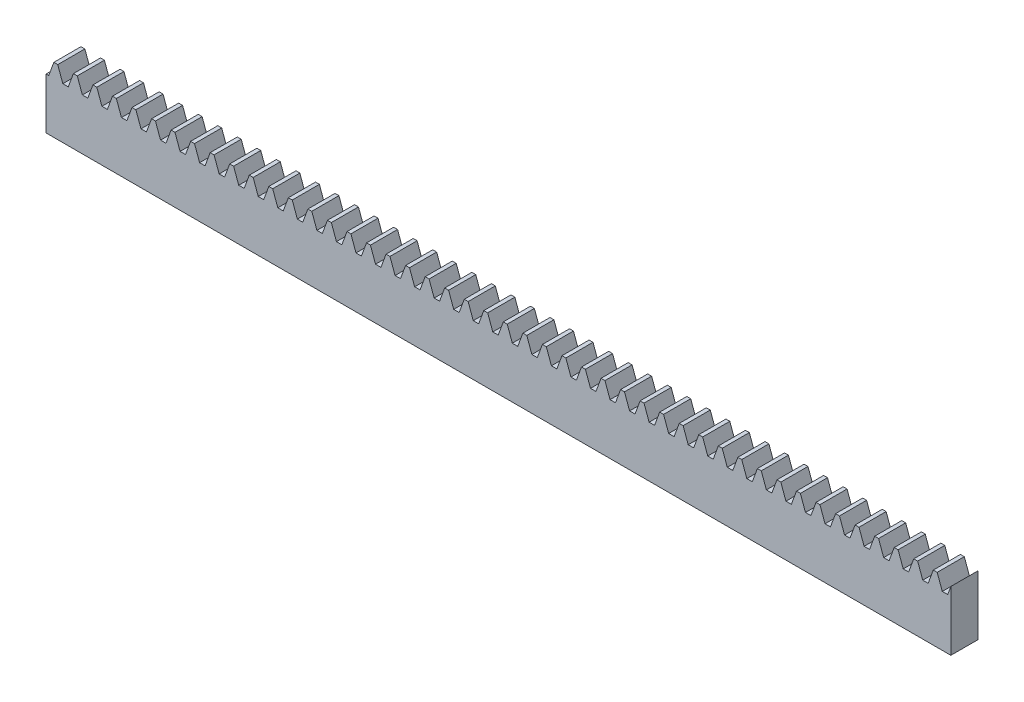
from build123d import *

# Parameters (mm, degrees)
BLANKSKE_W        = 200
BLANKSKE_H        = 14.375
BLANK_DEPTH       = 6
TOOTHCUTSIM_DEPTH = 201.605684428
TEETHCUTS_COUNT   = 47
TEETHCUTS_PITCH   = 4.319689894


with BuildPart() as part:
    # BlankSke → Blank (new body)
    with BuildSketch(Plane.XY):
        with Locations((100, 7.1875)):
            Rectangle(BLANKSKE_W, BLANKSKE_H)
    extrude(amount=-BLANK_DEPTH)

    # TooCutSkeSim → ToothCutSim (cut, through all)
    with BuildSketch(Plane.XY):
        Polygon((0.601348633, 11.28125), (-0.601348633, 11.28125), (-1.73662639, 14.4004), (1.73662639, 14.4004), align=None)
    toothcutsim = extrude(amount=-TOOTHCUTSIM_DEPTH, mode=Mode.SUBTRACT)

    # TeethCuts: ToothCutSim ×47
    with Locations(*[(i * TEETHCUTS_PITCH, 0, 0) for i in range(1, TEETHCUTS_COUNT)]):
        add(toothcutsim, mode=Mode.SUBTRACT)


solid = part.part
